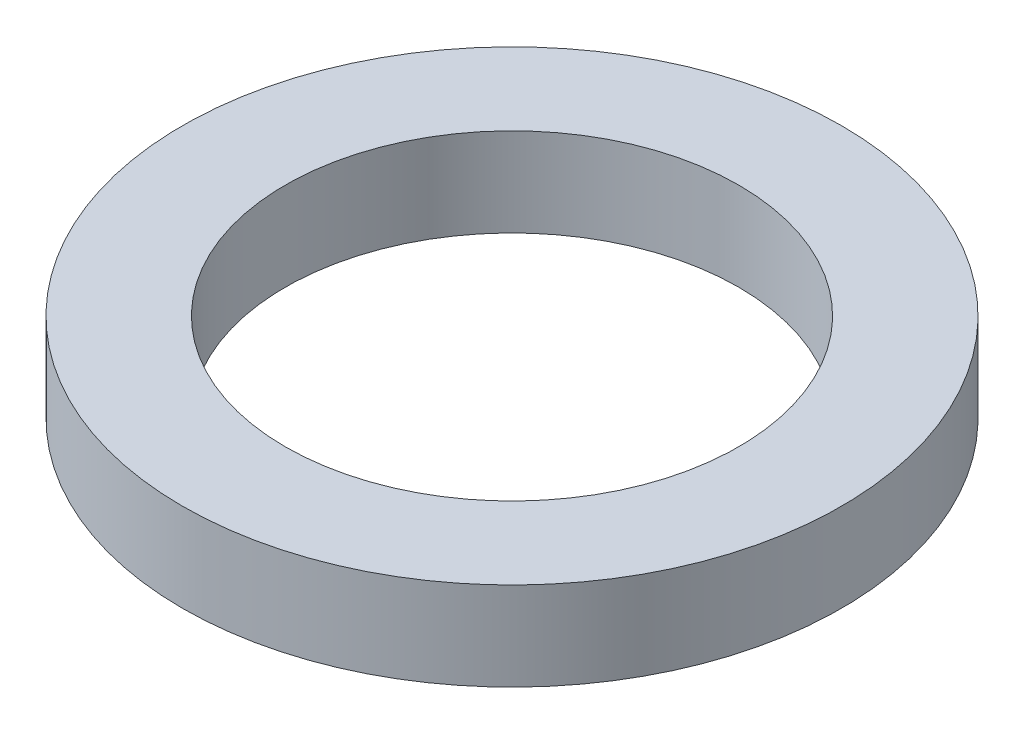
from build123d import *

# Parameters (mm, degrees)
SKETCH1_R           = 7.45
SKETCH1_R_2         = 5.125
BOSS_EXTRUDE1_DEPTH = 2


with BuildPart() as part:
    # Sketch1 → Boss-Extrude1 (new body)
    with BuildSketch(Plane(origin=(0, 0, 0), x_dir=(1, 0, 0), z_dir=(0, 1, 0))):
        with Locations(Location((0, 0, 0), (0, 0, 270))):
            Circle(SKETCH1_R)
        with Locations(Location((0, 0, 0), (0, 0, 270))):
            Circle(SKETCH1_R_2, mode=Mode.SUBTRACT)
    extrude(amount=BOSS_EXTRUDE1_DEPTH)


solid = part.part
